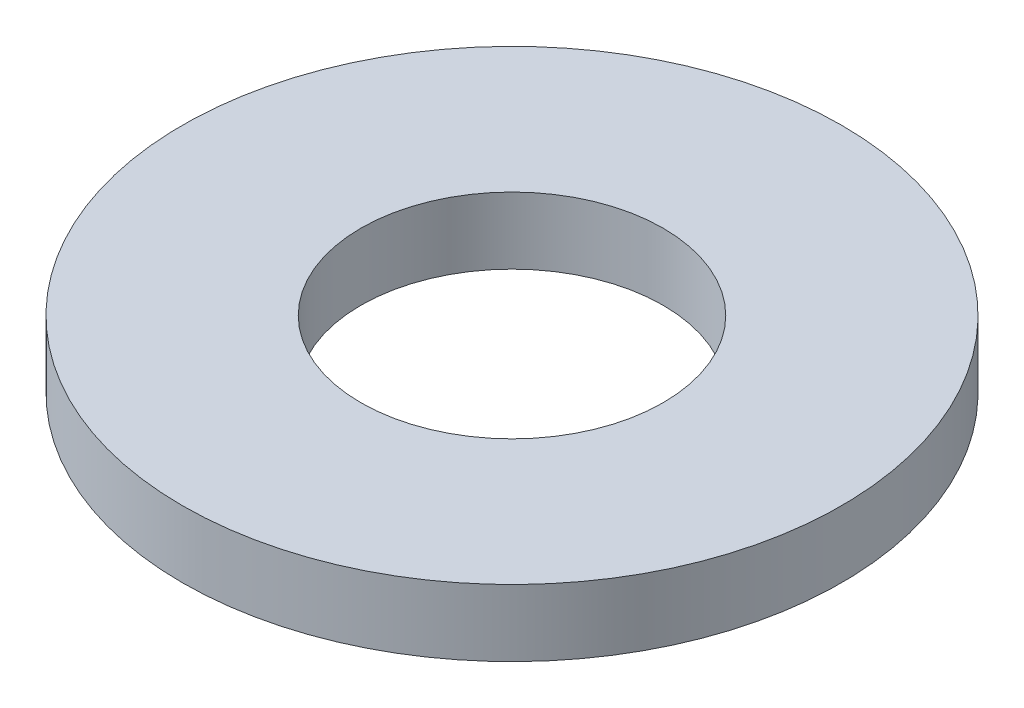
from build123d import *

# Parameters (mm, degrees)
SKETCH1_R           = 4.7625
BOSS_EXTRUDE1_DEPTH = 0.9652
SKETCH5_R           = 2.1844
CUT_EXTRUDE1_DEPTH  = 7.804000554


with BuildPart() as part:
    # Sketch1 → Boss-Extrude1 (new body)
    with BuildSketch(Plane(origin=(0, 0, 0), x_dir=(1, 0, 0), z_dir=(0, 1, 0))):
        with Locations(Location((0, 0, 0), (0, 0, 90))):
            Circle(SKETCH1_R)
    extrude(amount=BOSS_EXTRUDE1_DEPTH)

    # Sketch5 → Cut-Extrude1 (cut, through all)
    with BuildSketch(Plane(origin=(0, 0.9652, 0), x_dir=(-1, 0, 0), z_dir=(0, 1, 0))):
        with Locations(Location((0, 0, 0), (0, 0, 90))):
            Circle(SKETCH5_R)
    extrude(amount=-CUT_EXTRUDE1_DEPTH, mode=Mode.SUBTRACT)


solid = part.part
